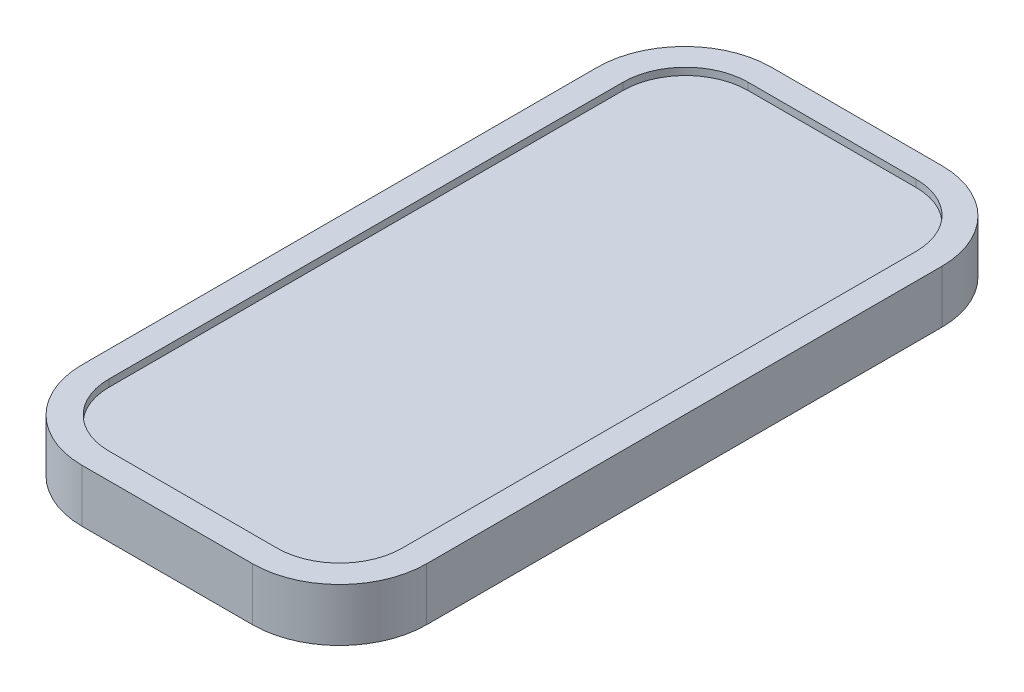
from build123d import *

# Parameters (mm, degrees)
BOSS_EXTRUDE2_DEPTH   = 10
BOSS_EXTRUDE3_DEPTH   = 19.05
BOSS_EXTRUDE4_DEPTH   = 120.65
BOSS_EXTRUDE7_START   = 5
SKETCH4_W             = 292.1
SKETCH4_H             = 50.8
BOSS_EXTRUDE7_DEPTH   = 115.65
BOSS_EXTRUDE7_2_DEPTH = 115.65
BOSS_EXTRUDE7_3_DEPTH = 115.65
BOSS_EXTRUDE7_4_DEPTH = 115.65


with BuildPart() as part:
    # Sketch1 → Boss-Extrude2 (new body)
    with BuildSketch(Plane(origin=(0, 0, 0), x_dir=(1, 0, 0), z_dir=(0, 1, 0))):
        with BuildLine():
            Line((165.1, 0), (609.6, 0))
            ThreePointArc((609.6, 0), (726.343329574, 48.356670426), (774.7, 165.1))
            Line((774.7, 165.1), (774.7, 1524))
            ThreePointArc((774.7, 1524), (726.343329574, 1640.743329574), (609.6, 1689.1))
            Line((609.6, 1689.1), (165.1, 1689.1))
            ThreePointArc((165.1, 1689.1), (48.356670426, 1640.743329574), (0, 1524))
            Line((0, 1524), (0, 165.1))
            ThreePointArc((0, 165.1), (48.356670426, 48.356670426), (165.1, 0))
        make_face()
    extrude(amount=-BOSS_EXTRUDE2_DEPTH)


with BuildPart() as body_2:
    # Sketch2 → Boss-Extrude3 (new body)
    with BuildSketch(Plane(origin=(0, 0, 0), x_dir=(1, 0, 0), z_dir=(0, 1, 0))):
        with BuildLine():
            Line((162.1025, -68.0875), (612.5975, -68.0875))
            ThreePointArc((612.5975, -68.0875), (775.366409961, -0.666409961), (842.7875, 162.1025))
            Line((842.7875, 162.1025), (842.7875, 1523.9975))
            ThreePointArc((842.7875, 1523.9975), (775.366409961, 1686.766409961), (612.5975, 1754.1875))
            Line((612.5975, 1754.1875), (162.1025, 1754.1875))
            ThreePointArc((162.1025, 1754.1875), (-0.666409961, 1686.766409961), (-68.0875, 1523.9975))
            Line((-68.0875, 1523.9975), (-68.0875, 162.1025))
            ThreePointArc((-68.0875, 162.1025), (-0.666409961, -0.666409961), (162.1025, -68.0875))
        make_face()
        with BuildLine():
            Line((165.1, 0), (609.6, 0))
            ThreePointArc((609.6, 0), (726.343329574, 48.356670426), (774.7, 165.1))
            Line((774.7, 165.1), (774.7, 1524))
            ThreePointArc((774.7, 1524), (726.343329574, 1640.743329574), (609.6, 1689.1))
            Line((609.6, 1689.1), (165.1, 1689.1))
            ThreePointArc((165.1, 1689.1), (48.356670426, 1640.743329574), (0, 1524))
            Line((0, 1524), (0, 165.1))
            ThreePointArc((0, 165.1), (48.356670426, 48.356670426), (165.1, 0))
        make_face(mode=Mode.SUBTRACT)
    extrude(amount=BOSS_EXTRUDE3_DEPTH)

    # Sketch3 → Boss-Extrude4 (add)
    with BuildSketch(Plane.XZ):
        with BuildLine():
            Line((162.1025, -1754.1875), (612.5975, -1754.1875))
            ThreePointArc((612.5975, -1754.1875), (775.366409961, -1686.766409961), (842.7875, -1523.9975))
            Line((842.7875, -1523.9975), (842.7875, -162.1025))
            ThreePointArc((842.7875, -162.1025), (775.366409961, 0.666409961), (612.5975, 68.0875))
            Line((612.5975, 68.0875), (162.1025, 68.0875))
            ThreePointArc((162.1025, 68.0875), (-0.666409961, 0.666409961), (-68.0875, -162.1025))
            Line((-68.0875, -162.1025), (-68.0875, -1523.9975))
            ThreePointArc((-68.0875, -1523.9975), (-0.666409961, -1686.766409961), (162.1025, -1754.1875))
        make_face()
        with BuildLine():
            Line((162.1025, -1734.1875), (612.5975, -1734.1875))
            ThreePointArc((612.5975, -1734.1875), (761.224274338, -1672.624274338), (822.7875, -1523.9975))
            Line((822.7875, -1523.9975), (822.7875, -162.1025))
            ThreePointArc((822.7875, -162.1025), (761.224274338, -13.475725662), (612.5975, 48.0875))
            Line((612.5975, 48.0875), (162.1025, 48.0875))
            ThreePointArc((162.1025, 48.0875), (13.475725662, -13.475725662), (-48.0875, -162.1025))
            Line((-48.0875, -162.1025), (-48.0875, -1523.9975))
            ThreePointArc((-48.0875, -1523.9975), (13.475725662, -1672.624274338), (162.1025, -1734.1875))
        make_face(mode=Mode.SUBTRACT)
    extrude(amount=BOSS_EXTRUDE4_DEPTH)


with BuildPart() as body_3:
    # Sketch4 → Boss-Extrude7 (new body)
    with BuildSketch(Plane.XZ.offset(BOSS_EXTRUDE7_START)):
        with Locations((387.3525, 22.6875)):
            Rectangle(SKETCH4_W, SKETCH4_H)
    extrude(amount=BOSS_EXTRUDE7_DEPTH)


with BuildPart() as body_4:
    # Sketch4 → Boss-Extrude7 2 (new body)
    with BuildSketch(Plane.XZ.offset(BOSS_EXTRUDE7_START)):
        Polygon((822.7875, -256.7125), (-48.0875, -256.7125), (-48.0875, -275.7625), (-48.0875, -364.6625), (40.8125, -364.6625), (40.8125, -275.7625), (733.8875, -275.7625), (733.8875, -364.6625), (822.7875, -364.6625), (822.7875, -275.7625), align=None)
    extrude(amount=BOSS_EXTRUDE7_2_DEPTH)


with BuildPart() as body_5:
    # Sketch4 → Boss-Extrude7 3 (new body)
    with BuildSketch(Plane.XZ.offset(BOSS_EXTRUDE7_START)):
        Polygon((822.7875, -224.9625), (558.8025, 48.0875), (576.467392336, 48.0875), (822.7875, -206.691011649), align=None)
    extrude(amount=BOSS_EXTRUDE7_3_DEPTH)


with BuildPart() as body_6:
    # Sketch4 → Boss-Extrude7 4 (new body)
    with BuildSketch(Plane.XZ.offset(BOSS_EXTRUDE7_START)):
        Polygon((215.9025, 48.0875), (-48.0875, -224.9625), (-48.0875, -206.69119052), (198.237446018, 48.0875), align=None)
    extrude(amount=BOSS_EXTRUDE7_4_DEPTH)


solid = Compound([part.part, body_2.part, body_3.part, body_4.part, body_5.part, body_6.part])
